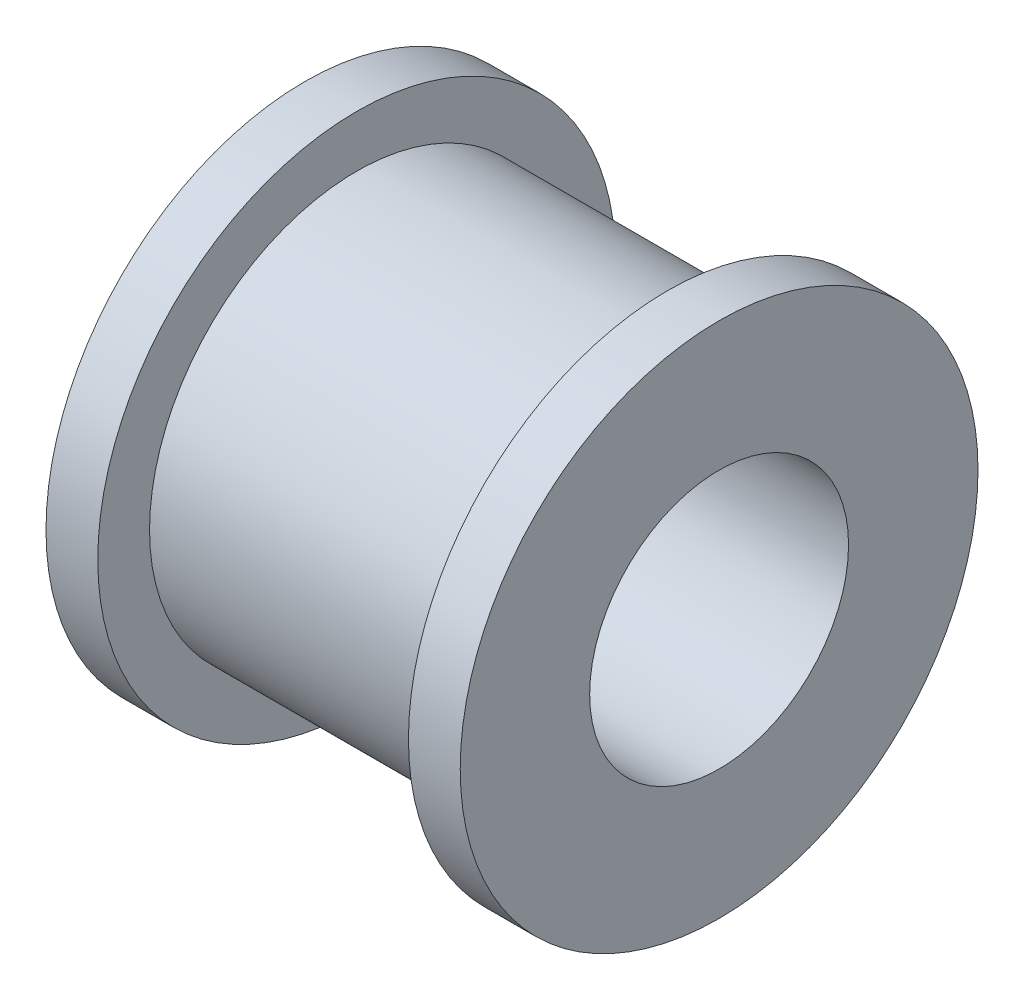
from build123d import *

# Parameters (mm, degrees)
SKETCH_1_R          = 5
SKETCH_1_R_2        = 2.5
EXTRUDE_1_DEPTH     = 8
SKETCH_2_R          = 5
SKETCH_2_R_2        = 4
CUT_EXTRUDE_1_DEPTH = 3


with BuildPart() as part:
    # 草图1 → 凸台-拉伸1 (new body)
    with BuildSketch(Plane(origin=(0, 0, 0), x_dir=(0, 0, -1), z_dir=(1, 0, 0))):
        Circle(SKETCH_1_R)
        Circle(SKETCH_1_R_2, mode=Mode.SUBTRACT)
    extrude(amount=EXTRUDE_1_DEPTH)

    # 草图2 → 切除-拉伸1 (cut, symmetric)
    with BuildSketch(Plane(origin=(4, 0, 0), x_dir=(0, 0, -1), z_dir=(1, 0, 0))):
        Circle(SKETCH_2_R)
        Circle(SKETCH_2_R_2, mode=Mode.SUBTRACT)
    extrude(amount=CUT_EXTRUDE_1_DEPTH, both=True, mode=Mode.SUBTRACT)


solid = part.part
